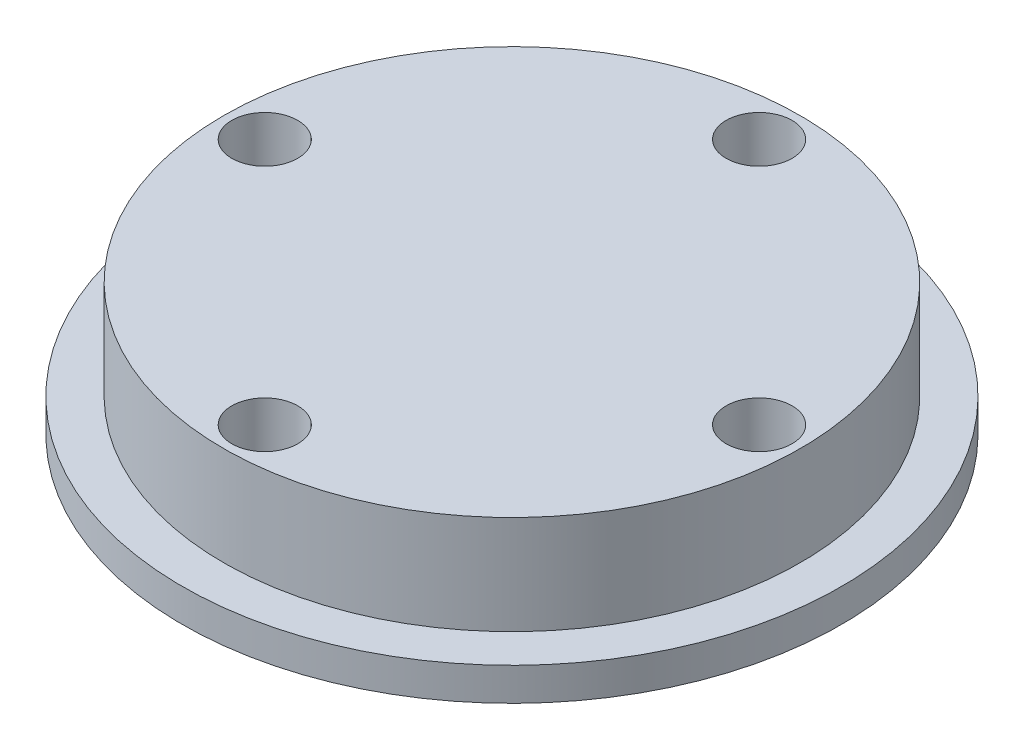
from build123d import *

# Parameters (mm, degrees)
CUT_EXTRUDE_1_REACH             = 31.394
SKETCH_3_R                      = 2
CUT_EXTRUDE_1_DIRECTION_2_DEPTH = 30.393876913


with BuildPart() as part:
    # 草图2 → 旋转1 (revolve)
    with BuildSketch(Plane.XY):
        Polygon((0, 0), (-20, 0), (-20, 2), (-17.5, 2), (-17.5, 8), (0, 8), align=None)
    revolve(axis=Axis((0, 8, 0), (0, -1, 0)))

    # 草图3 → 切除-拉伸1 (cut, up to next)
    with BuildSketch(Plane(origin=(0, 8, 0), x_dir=(1, 0, 0), z_dir=(0, 1, 0)), mode=Mode.PRIVATE) as cut_extrude_1_sk1:
        with Locations((0, 15)):
            Circle(SKETCH_3_R)
    cut_extrude_1_tool1 = extrude(cut_extrude_1_sk1.sketch, amount=-CUT_EXTRUDE_1_REACH, mode=Mode.PRIVATE) & part.part
    # 草图3 → 切除-拉伸1 (cut, up to next)
    with BuildSketch(Plane(origin=(0, 8, 0), x_dir=(1, 0, 0), z_dir=(0, 1, 0)), mode=Mode.PRIVATE) as cut_extrude_1_sk2:
        with Locations((15, 0)):
            Circle(SKETCH_3_R)
    cut_extrude_1_tool2 = extrude(cut_extrude_1_sk2.sketch, amount=-CUT_EXTRUDE_1_REACH, mode=Mode.PRIVATE) & part.part
    # 草图3 → 切除-拉伸1 (cut, up to next)
    with BuildSketch(Plane(origin=(0, 8, 0), x_dir=(1, 0, 0), z_dir=(0, 1, 0)), mode=Mode.PRIVATE) as cut_extrude_1_sk3:
        with Locations((0, -15)):
            Circle(SKETCH_3_R)
    cut_extrude_1_tool3 = extrude(cut_extrude_1_sk3.sketch, amount=-CUT_EXTRUDE_1_REACH, mode=Mode.PRIVATE) & part.part
    # 草图3 → 切除-拉伸1 (cut, up to next)
    with BuildSketch(Plane(origin=(0, 8, 0), x_dir=(1, 0, 0), z_dir=(0, 1, 0)), mode=Mode.PRIVATE) as cut_extrude_1_sk4:
        with Locations((-15, 0)):
            Circle(SKETCH_3_R)
    cut_extrude_1_tool4 = extrude(cut_extrude_1_sk4.sketch, amount=-CUT_EXTRUDE_1_REACH, mode=Mode.PRIVATE) & part.part
    add(cut_extrude_1_tool1.solids().sort_by_distance((0, 8, -15))[0], mode=Mode.SUBTRACT)
    add(cut_extrude_1_tool2.solids().sort_by_distance((15, 8, 0))[0], mode=Mode.SUBTRACT)
    add(cut_extrude_1_tool3.solids().sort_by_distance((0, 8, 15))[0], mode=Mode.SUBTRACT)
    add(cut_extrude_1_tool4.solids().sort_by_distance((-15, 8, 0))[0], mode=Mode.SUBTRACT)

    # 草图3 → 切除-拉伸1 direction 2 (cut)
    with BuildSketch(Plane(origin=(0, 8, 0), x_dir=(1, 0, 0), z_dir=(0, 1, 0))):
        with Locations((0, 15)):
            Circle(SKETCH_3_R)
        with Locations((15, 0)):
            Circle(SKETCH_3_R)
        with Locations((0, -15)):
            Circle(SKETCH_3_R)
        with Locations((-15, 0)):
            Circle(SKETCH_3_R)
    extrude(amount=CUT_EXTRUDE_1_DIRECTION_2_DEPTH, mode=Mode.SUBTRACT)


solid = part.part
